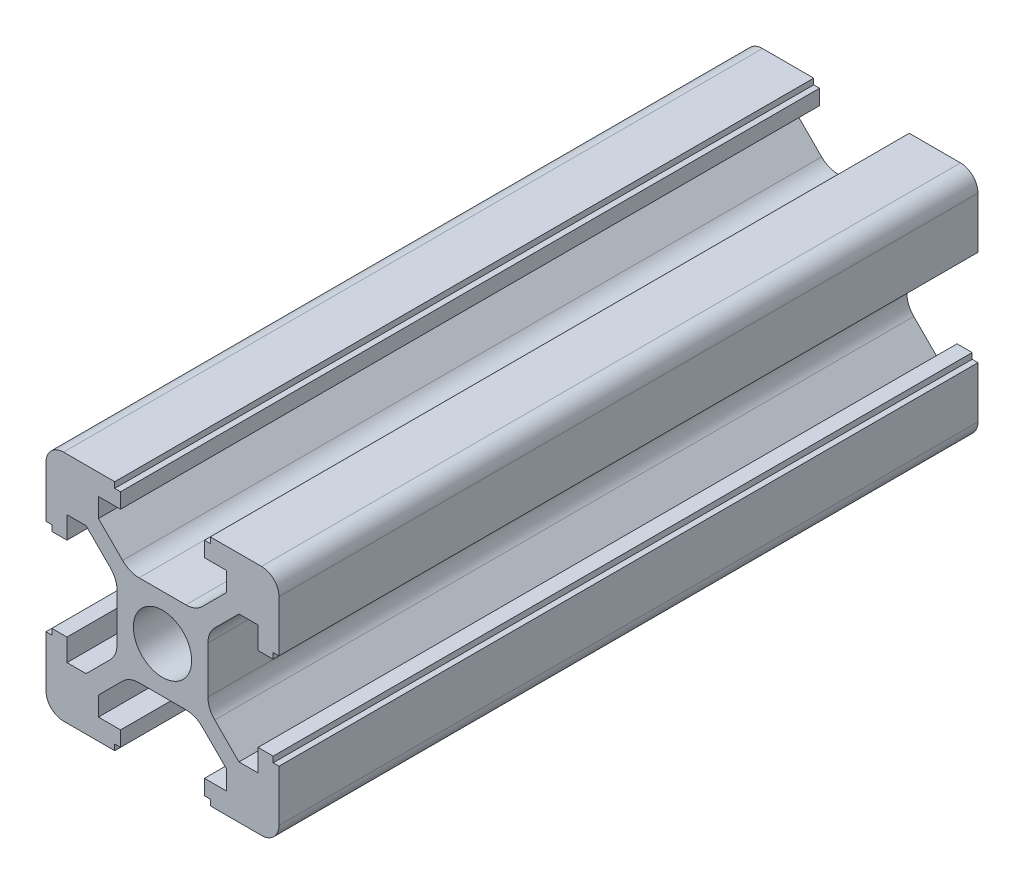
from build123d import *

# Parameters (mm, degrees)
SKETCH1_R           = 2.5
BOSS_EXTRUDE2_DEPTH = 60


with BuildPart() as part:
    # Sketch1 → Boss-Extrude2 (new body)
    with BuildSketch(Plane.XY):
        with BuildLine():
            Line((10, -4.1), (10, -8.5))
            ThreePointArc((10, -8.5), (9.560660172, -9.560660172), (8.5, -10))
            Line((8.5, -10), (4.1, -10))
            Line((4.1, -10), (4.1, -9.5))
            Line((4.1, -9.5), (3.6, -9.5))
            Line((3.6, -9.5), (3.6, -8.2))
            Line((3.6, -8.2), (5.5, -8.2))
            Line((5.5, -8.2), (5.5, -6.560660172))
            Line((5.5, -6.560660172), (3.425126266, -4.485786438))
            ThreePointArc((3.425126266, -4.485786438), (2.776279568, -4.052240935), (2.010912703, -3.9))
            Line((2.010912703, -3.9), (-2.010912703, -3.9))
            ThreePointArc((-2.010912703, -3.9), (-2.776279568, -4.052240935), (-3.425126266, -4.485786438))
            Line((-3.425126266, -4.485786438), (-5.5, -6.560660172))
            Line((-5.5, -6.560660172), (-5.5, -8.2))
            Line((-5.5, -8.2), (-3.6, -8.2))
            Line((-3.6, -8.2), (-3.6, -9.5))
            Line((-3.6, -9.5), (-4.1, -9.5))
            Line((-4.1, -9.5), (-4.1, -10))
            Line((-4.1, -10), (-8.5, -10))
            ThreePointArc((-8.5, -10), (-9.560660172, -9.560660172), (-10, -8.5))
            Line((-10, -8.5), (-10, -4.1))
            Line((-10, -4.1), (-9.5, -4.1))
            Line((-9.5, -4.1), (-9.5, -3.6))
            Line((-9.5, -3.6), (-8.2, -3.6))
            Line((-8.2, -3.6), (-8.2, -5.5))
            Line((-8.2, -5.5), (-6.560660172, -5.5))
            Line((-6.560660172, -5.5), (-4.485786438, -3.425126266))
            ThreePointArc((-4.485786438, -3.425126266), (-4.052240935, -2.776279568), (-3.9, -2.010912703))
            Line((-3.9, -2.010912703), (-3.9, 2.010912703))
            ThreePointArc((-3.9, 2.010912703), (-4.052240935, 2.776279568), (-4.485786438, 3.425126266))
            Line((-4.485786438, 3.425126266), (-6.560660172, 5.5))
            Line((-6.560660172, 5.5), (-8.2, 5.5))
            Line((-8.2, 5.5), (-8.2, 3.6))
            Line((-8.2, 3.6), (-9.5, 3.6))
            Line((-9.5, 3.6), (-9.5, 4.1))
            Line((-9.5, 4.1), (-10, 4.1))
            Line((-10, 4.1), (-10, 8.5))
            ThreePointArc((-10, 8.5), (-9.560660172, 9.560660172), (-8.5, 10))
            Line((-8.5, 10), (-4.1, 10))
            Line((-4.1, 10), (-4.1, 9.5))
            Line((-4.1, 9.5), (-3.6, 9.5))
            Line((-3.6, 9.5), (-3.6, 8.2))
            Line((-3.6, 8.2), (-5.5, 8.2))
            Line((-5.5, 8.2), (-5.5, 6.560660172))
            Line((-5.5, 6.560660172), (-3.425126266, 4.485786438))
            ThreePointArc((-3.425126266, 4.485786438), (-2.776279568, 4.052240935), (-2.010912703, 3.9))
            Line((-2.010912703, 3.9), (2.010912703, 3.9))
            ThreePointArc((2.010912703, 3.9), (2.776279568, 4.052240935), (3.425126266, 4.485786438))
            Line((3.425126266, 4.485786438), (5.5, 6.560660172))
            Line((5.5, 6.560660172), (5.5, 8.2))
            Line((5.5, 8.2), (3.6, 8.2))
            Line((3.6, 8.2), (3.6, 9.5))
            Line((3.6, 9.5), (4.1, 9.5))
            Line((4.1, 9.5), (4.1, 10))
            Line((4.1, 10), (8.5, 10))
            ThreePointArc((8.5, 10), (9.560660172, 9.560660172), (10, 8.5))
            Line((10, 8.5), (10, 4.1))
            Line((10, 4.1), (9.5, 4.1))
            Line((9.5, 4.1), (9.5, 3.6))
            Line((9.5, 3.6), (8.2, 3.6))
            Line((8.2, 3.6), (8.2, 5.5))
            Line((8.2, 5.5), (6.560660172, 5.5))
            Line((6.560660172, 5.5), (4.485786438, 3.425126266))
            ThreePointArc((4.485786438, 3.425126266), (4.052240935, 2.776279568), (3.9, 2.010912703))
            Line((3.9, 2.010912703), (3.9, -2.010912703))
            ThreePointArc((3.9, -2.010912703), (4.052240935, -2.776279568), (4.485786438, -3.425126266))
            Line((4.485786438, -3.425126266), (6.560660172, -5.5))
            Line((6.560660172, -5.5), (8.2, -5.5))
            Line((8.2, -5.5), (8.2, -3.6))
            Line((8.2, -3.6), (9.5, -3.6))
            Line((9.5, -3.6), (9.5, -4.1))
            Line((9.5, -4.1), (10, -4.1))
        make_face()
        Circle(SKETCH1_R, mode=Mode.SUBTRACT)
    extrude(amount=BOSS_EXTRUDE2_DEPTH)


solid = part.part
